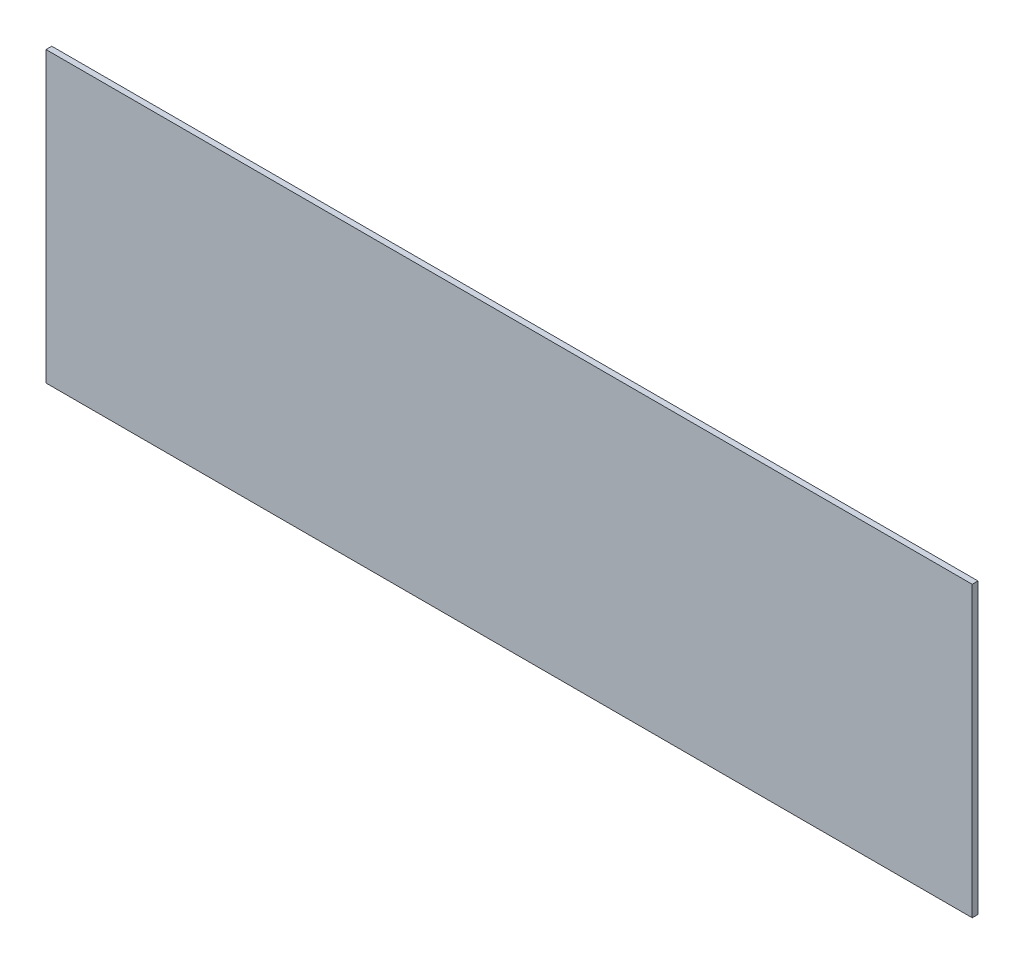
from build123d import *

# Parameters (mm, degrees)
SKETCH_1_W      = 962
SKETCH_1_H      = 300
EXTRUDE_1_DEPTH = 6


with BuildPart() as part:
    # Эскиз1 → Бобышка-Вытянуть1 (new body)
    with BuildSketch(Plane.XY):
        Rectangle(SKETCH_1_W, SKETCH_1_H)
    extrude(amount=EXTRUDE_1_DEPTH)


solid = part.part
